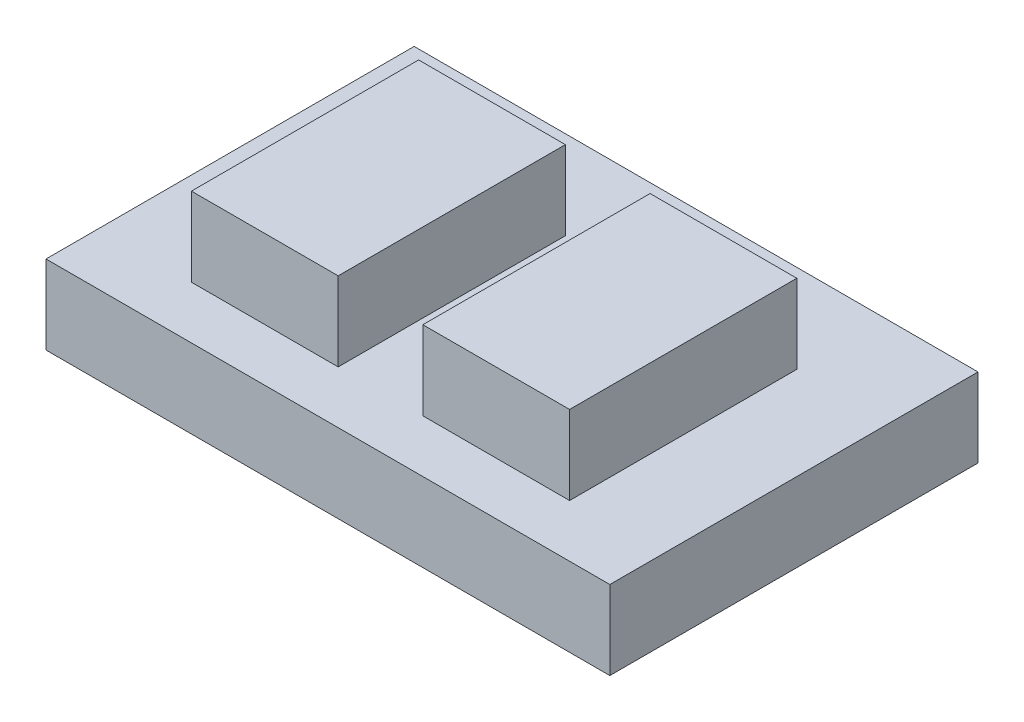
from build123d import *

# Parameters (mm, degrees)
SKETCH1_W           = 10.72
SKETCH1_H           = 7
BOSS_EXTRUDE1_DEPTH = 1.5
SKETCH2_W           = 2.79
SKETCH2_H           = 4.32
BOSS_EXTRUDE2_DEPTH = 1.5


with BuildPart() as part:
    # Sketch1 → Boss-Extrude1 (new body)
    with BuildSketch(Plane(origin=(0, 0, 0), x_dir=(1, 0, 0), z_dir=(0, 1, 0))):
        Rectangle(SKETCH1_W, SKETCH1_H)
    extrude(amount=BOSS_EXTRUDE1_DEPTH)

    # Sketch2 → Boss-Extrude2 (add)
    with BuildSketch(Plane(origin=(0, 1.5, 0), x_dir=(1, 0, 0), z_dir=(0, 1, 0))):
        with Locations((-2.2, -0.34)):
            Rectangle(SKETCH2_W, SKETCH2_H)
        with Locations((2.2, -0.34)):
            Rectangle(SKETCH2_W, SKETCH2_H)
    extrude(amount=BOSS_EXTRUDE2_DEPTH)


solid = part.part
